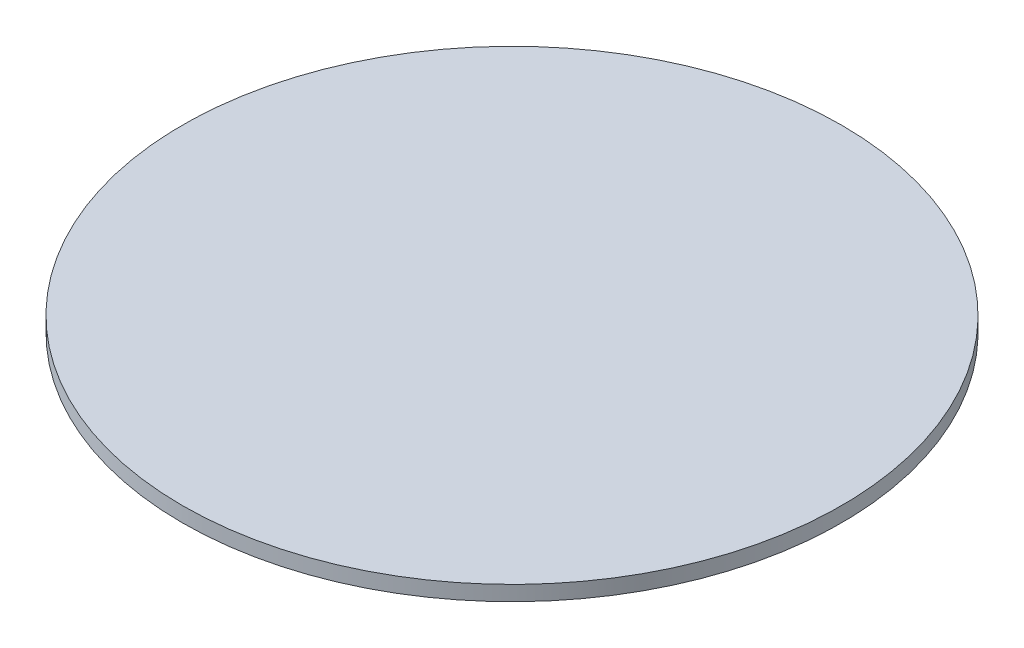
from build123d import *

# Parameters (mm, degrees)
SKETCH1_R           = 44
BOSS_EXTRUDE1_DEPTH = 2


with BuildPart() as part:
    # Sketch1 → Boss-Extrude1 (new body)
    with BuildSketch(Plane(origin=(0, 0, 0), x_dir=(1, 0, 0), z_dir=(0, 1, 0))):
        with Locations(Location((0, 0, 0), (0, 0, 270))):
            Circle(SKETCH1_R)
    extrude(amount=-BOSS_EXTRUDE1_DEPTH)


solid = part.part
